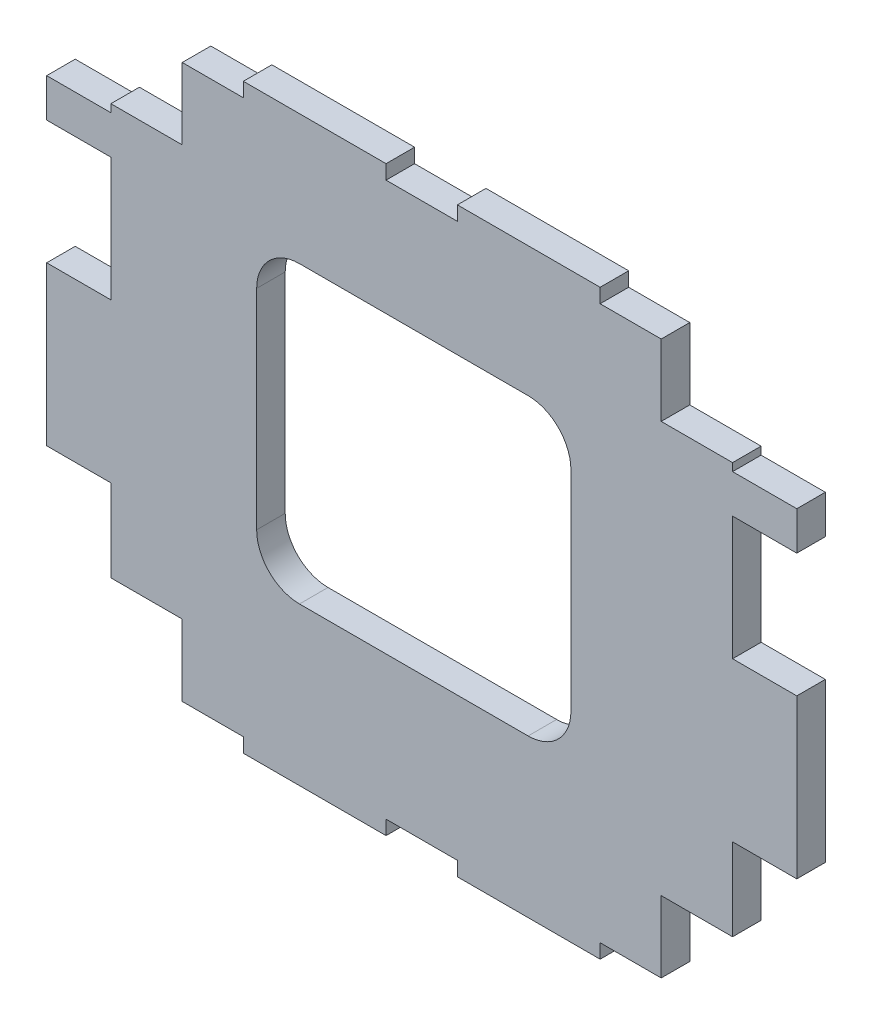
from build123d import *

# Parameters (mm, degrees)
EXTRUDE_1_DEPTH = 2


with BuildPart() as part:
    # Model → 凸台-拉伸1 (new body)
    with BuildSketch(Plane.XY):
        Polygon((33.5739334, 44.005023309), (37.8539334, 44.005023309), (37.8539334, 45.005379015), (47.8539334, 45.005379015), (47.8539334, 44.005023309), (52.8539334, 44.005023309), (52.8539334, 45.005379015), (62.8539334, 45.005379015), (62.8539334, 44.005023309), (67.1339334, 44.005023309), (67.1339334, 39.005023309), (72.1339334, 39.005023309), (72.1339334, 38.457134168), (76.6339334, 38.457134168), (76.6339334, 35.759524505), (72.1339334, 35.759524505), (72.1339334, 27.10105698), (76.6339334, 27.10105698), (76.6339334, 15.994019606), (72.1339334, 15.994019606), (72.1339334, 10.230267781), (67.1339334, 10.230267781), (67.1339334, 5.230267781), (62.8539334, 5.230267781), (62.8539334, 4.229912075), (52.8539334, 4.229912075), (52.8539334, 5.230267781), (47.8539334, 5.230267781), (47.8539334, 4.229912075), (37.8539334, 4.229912075), (37.8539334, 5.230267781), (33.5739334, 5.230267781), (33.5739334, 10.230267781), (28.5739334, 10.230267781), (28.5739334, 15.994019606), (24.0739334, 15.994019606), (24.0739334, 27.10105698), (28.5739334, 27.10105698), (28.5739334, 35.759524505), (24.0739334, 35.759524505), (24.0739334, 38.457134168), (28.5739334, 38.457134168), (28.5739334, 39.005023309), (33.5739334, 39.005023309), align=None)
        with BuildLine():
            Line((57.808112517, 35.90503424), (41.788112517, 35.90503424))
            ThreePointArc((41.788112517, 35.90503424), (39.666792174, 35.026354583), (38.788112517, 32.90503424))
            Line((38.788112517, 32.90503424), (38.788112517, 18.25503424))
            ThreePointArc((38.788112517, 18.25503424), (39.666792174, 16.133713896), (41.788112517, 15.25503424))
            Line((41.788112517, 15.25503424), (57.808112517, 15.25503424))
            ThreePointArc((57.808112517, 15.25503424), (59.929432861, 16.133713896), (60.808112517, 18.25503424))
            Line((60.808112517, 18.25503424), (60.808112517, 32.90503424))
            ThreePointArc((60.808112517, 32.90503424), (59.929432861, 35.026354583), (57.808112517, 35.90503424))
        make_face(mode=Mode.SUBTRACT)
    extrude(amount=EXTRUDE_1_DEPTH)


solid = part.part
